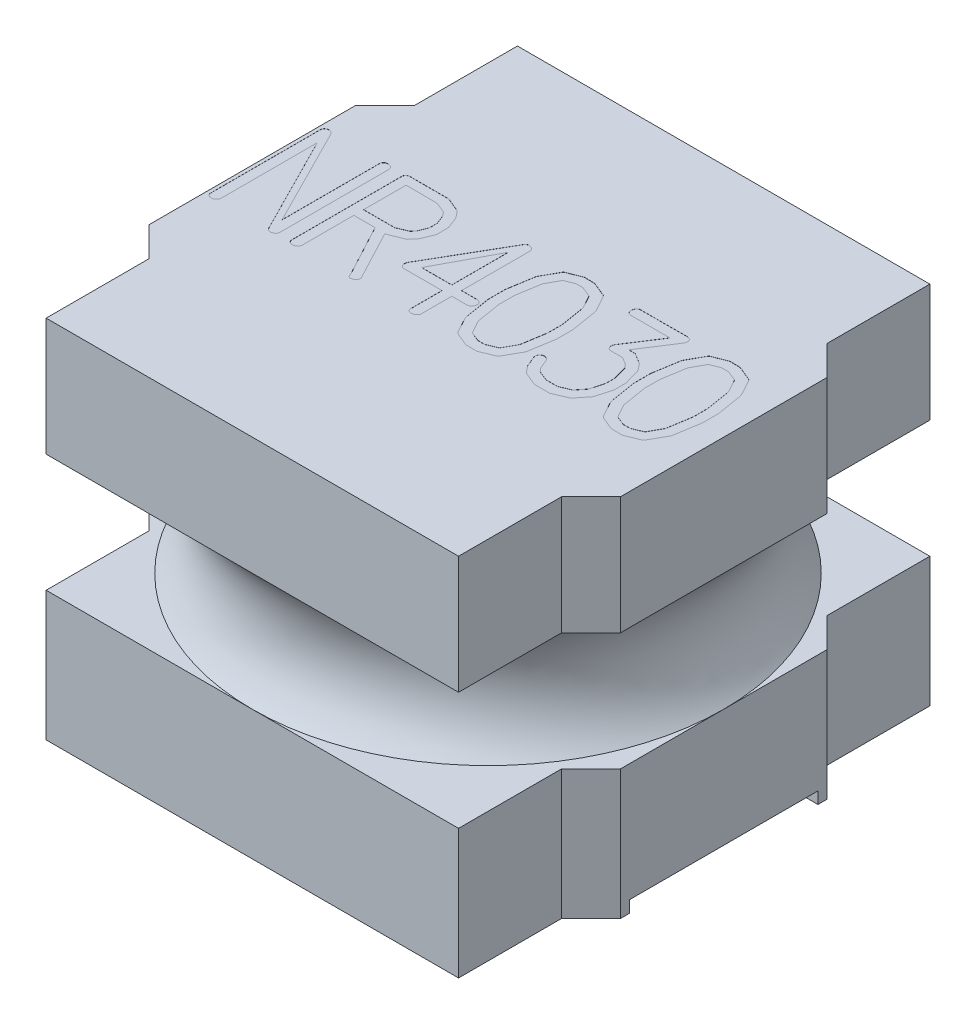
from build123d import *

# Parameters (mm, degrees)
BOSS_EXTRUDE1_START = -1.5
BOSS_EXTRUDE1_DEPTH = 1
CUT_EXTRUDE1_DEPTH  = 0.001
BOSS_EXTRUDE2_DEPTH = 0.1


with BuildPart() as part:
    # Sketch1 → Boss-Extrude1 (new body)
    with BuildSketch(Plane(origin=(0, 0, 0), x_dir=(1, 0, 0), z_dir=(0, 1, 0)).offset(BOSS_EXTRUDE1_START)):
        Polygon((-1.75, 2), (1.75, 2), (1.75, 1.125), (2, 0.875), (2, -0.875), (1.75, -1.125), (1.75, -2), (-1.75, -2), (-1.75, -1.125), (-2, -0.875), (-2, 0.875), (-1.75, 1.125), align=None)
    boss_extrude1 = extrude(amount=BOSS_EXTRUDE1_DEPTH)

    # Sketch2 → Revolve1 (revolve)
    with BuildSketch(Plane(origin=(0, 0, 0), x_dir=(0, 0, -1), z_dir=(1, 0, 0)), mode=Mode.PRIVATE) as revolve1_sk:
        with BuildLine():
            Line((-2, 0.5), (0, 0.5))
            Line((0, 0.5), (0, -0.5))
            Line((0, -0.5), (-2, -0.5))
            ThreePointArc((-2, -0.5), (-1.809016994, 0), (-2, 0.5))
        make_face()
    revolve(revolve1_sk.sketch.rotate(Axis((0, -1.5, 0), (0, 1, 0)), 180), axis=Axis((0, -1.5, 0), (0, 1, 0)))

    # Mirror1: Boss-Extrude1 across plane
    add(boss_extrude1.mirror(Plane.ZX))

    # Sketch3 → Cut-Extrude1 (cut)
    # profile 1 of 6: a face of its own
    with BuildSketch(Plane(origin=(0, 1.5, 0), x_dir=(1, 0, 0), z_dir=(0, 1, 0))):
        with BuildLine():
            Line((-1.896763393, 0.565182545), (-1.47172619, -0.275777276))
            Line((-1.47172619, -0.275777276), (-1.47172619, 0.556439986))
            add(Edge.make_bspline(
                [(-1.47172619, 0.556439986), (-1.470306395, 0.560142119), (-1.467630722, 0.567118969), (-1.460760161, 0.575623855), (-1.452434536, 0.581976469), (-1.445838877, 0.583797906), (-1.442522321, 0.584713795)],
                knots=[0, 0, 0, 0, 1.109185066, 2.09031286, 3.039734632, 4, 4, 4, 4], degree=3))
            add(Edge.make_bspline(
                [(-1.442522321, 0.584713795), (-1.436038113, 0.584478157), (-1.424379293, 0.584054471), (-1.408951724, 0.580032187), (-1.397195814, 0.572686768), (-1.393633727, 0.565223886), (-1.391927083, 0.561648319)],
                knots=[0, 0, 0, 0, 1.309736388, 2.354949205, 3.211834253, 4, 4, 4, 4], degree=3))
            Line((-1.391927083, 0.561648319), (-1.388392857, 0.549557545))
            Line((-1.388392857, 0.549557545), (-1.388392857, -0.383478169))
            add(Edge.make_bspline(
                [(-1.388392857, -0.383478169), (-1.389803322, -0.387527534), (-1.392568979, -0.395467575), (-1.401548089, -0.405193133), (-1.413923051, -0.411867685), (-1.423471144, -0.414095942), (-1.428571429, -0.415286205)],
                knots=[0, 0, 0, 0, 0.93883371, 1.840875961, 2.846665492, 4, 4, 4, 4], degree=3))
            add(Edge.make_bspline(
                [(-1.428571429, -0.415286205), (-1.432188471, -0.415176507), (-1.438883743, -0.414973452), (-1.447870125, -0.412720635), (-1.455385705, -0.409366324), (-1.458511029, -0.405444995), (-1.46000744, -0.403567455)],
                knots=[0, 0, 0, 0, 1.240813366, 2.296788812, 3.184498919, 4, 4, 4, 4], degree=3))
            Line((-1.46000744, -0.403567455), (-1.466517857, -0.394452871))
            Line((-1.466517857, -0.394452871), (-1.888392857, 0.439066474))
            Line((-1.888392857, 0.439066474), (-1.888392857, -0.381804062))
            add(Edge.make_bspline(
                [(-1.888392857, -0.381804062), (-1.889479385, -0.384979641), (-1.891736312, -0.391575932), (-1.898454551, -0.400472129), (-1.907811787, -0.408500211), (-1.915283117, -0.412924698), (-1.919270833, -0.415286205)],
                knots=[0, 0, 0, 0, 0.855881606, 1.777831308, 2.813949167, 4, 4, 4, 4], degree=3))
            Line((-1.919270833, -0.415286205), (-1.936011905, -0.415286205))
            add(Edge.make_bspline(
                [(-1.936011905, -0.415286205), (-1.938636346, -0.415227468), (-1.943726483, -0.415113546), (-1.950770904, -0.41286715), (-1.957229509, -0.410001889), (-1.962385618, -0.405405544), (-1.966543861, -0.399955988), (-1.969492153, -0.393737282), (-1.971498185, -0.386887024), (-1.971648412, -0.382067298), (-1.97172619, -0.379571919)],
                knots=[0, 0, 0, 0, 1.101665817, 2.136695196, 3.096220978, 4.06108244, 5.013447482, 5.972973263, 6.950521542, 8, 8, 8, 8], degree=3))
            Line((-1.97172619, -0.379571919), (-1.97172619, 0.554765879))
            add(Edge.make_bspline(
                [(-1.97172619, 0.554765879), (-1.970424232, 0.558274857), (-1.967871956, 0.56515363), (-1.960801213, 0.573792575), (-1.951543686, 0.58051624), (-1.944281464, 0.583270574), (-1.94047619, 0.584713795)],
                knots=[0, 0, 0, 0, 0.990101851, 1.940931574, 2.921085177, 4, 4, 4, 4], degree=3))
            add(Edge.make_bspline(
                [(-1.94047619, 0.584713795), (-1.936111566, 0.584449349), (-1.927664385, 0.583937548), (-1.915640252, 0.580381328), (-1.905043333, 0.574120683), (-1.899546284, 0.568186656), (-1.896763393, 0.565182545)],
                knots=[0, 0, 0, 0, 1.057654734, 2.046957308, 3.011268782, 4, 4, 4, 4], degree=3))
        make_face()
    # profile 2 of 6: a face of its own
    with BuildSketch(Plane(origin=(0, 1.5, 0), x_dir=(1, 0, 0), z_dir=(0, 1, 0))):
        with BuildLine():
            add(Edge.make_bspline(
                [(-0.916220238, 0.584713795), (-0.912819184, 0.583142877), (-0.905559586, 0.579789729), (-0.89386605, 0.574930794), (-0.881004782, 0.569184691), (-0.866662817, 0.563360852), (-0.851012308, 0.556763425), (-0.833973993, 0.54981334), (-0.815704558, 0.542046263), (-0.803010382, 0.53694798), (-0.796428571, 0.534304569)],
                knots=[0, 0, 0, 0, 0.69170389, 1.476452024, 2.33788276, 3.292567323, 4.33444127, 5.47407891, 6.69033371, 8, 8, 8, 8], degree=3))
            add(Edge.make_bspline(
                [(-0.796428571, 0.534304569), (-0.795365255, 0.533196905), (-0.792871733, 0.530599387), (-0.788930193, 0.52599228), (-0.783955072, 0.520404772), (-0.778535116, 0.513460678), (-0.771870613, 0.505651651), (-0.764518356, 0.496576426), (-0.75632609, 0.48635153), (-0.750662632, 0.479126604), (-0.747693452, 0.475338795)],
                knots=[0, 0, 0, 0, 0.481485898, 1.129104191, 1.901129329, 2.827469681, 3.890672923, 5.120764969, 6.490504369, 8, 8, 8, 8], degree=3))
            Line((-0.747693452, 0.475338795), (-0.708630952, 0.375636414))
            add(Edge.make_bspline(
                [(-0.708630952, 0.375636414), (-0.708442783, 0.369250132), (-0.708022631, 0.354990646), (-0.707378502, 0.33130738), (-0.707353284, 0.303153309), (-0.707216213, 0.282878298), (-0.707142857, 0.272027783)],
                knots=[0, 0, 0, 0, 0.739877275, 1.652020808, 2.743439316, 4, 4, 4, 4], degree=3))
            add(Edge.make_bspline(
                [(-0.707142857, 0.272027783), (-0.708833753, 0.268066448), (-0.712414149, 0.259678499), (-0.7177127, 0.246282734), (-0.723686208, 0.231596438), (-0.729956446, 0.216247789), (-0.735895517, 0.2014471), (-0.740808214, 0.188334392), (-0.745137178, 0.177862838), (-0.747576349, 0.171646102), (-0.748623512, 0.168977188)],
                knots=[0, 0, 0, 0, 0.930477767, 1.970244378, 3.112005238, 4.355764031, 5.552241039, 6.557257016, 7.380614275, 8, 8, 8, 8], degree=3))
            Line((-0.748623512, 0.168977188), (-0.796056548, 0.112615581))
            Line((-0.796056548, 0.112615581), (-0.802380952, 0.108523319))
            Line((-0.802380952, 0.108523319), (-0.918452381, 0.060904271))
            Line((-0.918452381, 0.060904271), (-0.93500744, 0.060904271))
            Line((-0.93500744, 0.060904271), (-0.71235119, -0.359668645))
            add(Edge.make_bspline(
                [(-0.71235119, -0.359668645), (-0.710840542, -0.362518567), (-0.708167134, -0.367562101), (-0.70745332, -0.373209441), (-0.707142857, -0.375665669)],
                knots=[0, 0, 0, 0, 1.130128936, 2, 2, 2, 2], degree=3))
            add(Edge.make_bspline(
                [(-0.707142857, -0.375665669), (-0.707288041, -0.379102057), (-0.707558426, -0.385501872), (-0.710834301, -0.390984218), (-0.71235119, -0.393522812)],
                knots=[0, 0, 0, 0, 1.073902397, 2, 2, 2, 2], degree=3))
            add(Edge.make_bspline(
                [(-0.71235119, -0.393522812), (-0.714349654, -0.396902888), (-0.718452493, -0.403842171), (-0.729761392, -0.410547182), (-0.743987225, -0.414627787), (-0.754660614, -0.414932615), (-0.760528274, -0.415100193)],
                knots=[0, 0, 0, 0, 0.833397318, 1.710961782, 2.741608977, 4, 4, 4, 4], degree=3))
            add(Edge.make_bspline(
                [(-0.760528274, -0.415100193), (-0.763007493, -0.413961421), (-0.768484487, -0.41144569), (-0.774695764, -0.403152782), (-0.780230676, -0.39201179), (-0.7828736, -0.383168872), (-0.784337798, -0.378269836)],
                knots=[0, 0, 0, 0, 0.710807694, 1.570288236, 2.65392335, 4, 4, 4, 4], degree=3))
            Line((-0.784337798, -0.378269836), (-1.019084821, 0.060904271))
            Line((-1.019084821, 0.060904271), (-1.199702381, 0.060904271))
            Line((-1.199702381, 0.060904271), (-1.199702381, -0.381990074))
            add(Edge.make_bspline(
                [(-1.199702381, -0.381990074), (-1.200703143, -0.385179467), (-1.202800313, -0.391863072), (-1.209811821, -0.400575425), (-1.219115439, -0.408814022), (-1.226813628, -0.413023225), (-1.230952381, -0.415286205)],
                knots=[0, 0, 0, 0, 0.845387553, 1.771571109, 2.801936792, 4, 4, 4, 4], degree=3))
            Line((-1.230952381, -0.415286205), (-1.247321429, -0.415286205))
            add(Edge.make_bspline(
                [(-1.247321429, -0.415286205), (-1.24994587, -0.415227468), (-1.255036007, -0.415113546), (-1.262080428, -0.41286715), (-1.268539033, -0.410001889), (-1.273695142, -0.405405544), (-1.277853385, -0.399955988), (-1.280801676, -0.393737282), (-1.282807708, -0.386887024), (-1.282957935, -0.382067298), (-1.283035714, -0.379571919)],
                knots=[0, 0, 0, 0, 1.101665817, 2.136695196, 3.096220978, 4.06108244, 5.013447482, 5.972973263, 6.950521542, 8, 8, 8, 8], degree=3))
            Line((-1.283035714, -0.379571919), (-1.283035714, 0.55588195))
            add(Edge.make_bspline(
                [(-1.283035714, 0.55588195), (-1.281821214, 0.559642222), (-1.279498142, 0.566834794), (-1.272703477, 0.575716703), (-1.263696193, 0.582136738), (-1.256595062, 0.583832062), (-1.252901786, 0.584713795)],
                knots=[0, 0, 0, 0, 1.064767976, 2.036666745, 2.978876548, 4, 4, 4, 4], degree=3))
            Line((-1.252901786, 0.584713795), (-0.916220238, 0.584713795))
        make_face()
        Polygon((-0.843861607, 0.466224212), (-0.934077381, 0.503054569), (-1.199702381, 0.504356652), (-1.199702381, 0.144237605), (-0.935379464, 0.144237605), (-0.843861607, 0.183300105), (-0.818377976, 0.214178081), (-0.787686012, 0.289698914), (-0.787686012, 0.357593259), (-0.818377976, 0.433114093), align=None, mode=Mode.SUBTRACT)
    # profile 3 of 6: a face of its own
    with BuildSketch(Plane(origin=(0, 1.5, 0), x_dir=(1, 0, 0), z_dir=(0, 1, 0))):
        with BuildLine():
            Line((-0.194233631, 0.561648319), (-0.189583333, 0.548813498))
            Line((-0.189583333, 0.548813498), (-0.189583333, -0.034333824))
            Line((-0.189583333, -0.034333824), (-0.055654762, -0.034519836))
            add(Edge.make_bspline(
                [(-0.055654762, -0.034519836), (-0.0505191, -0.035845237), (-0.04111382, -0.038272532), (-0.029358132, -0.045828156), (-0.021335425, -0.0563029), (-0.019798957, -0.064648792), (-0.019010417, -0.068932038)],
                knots=[0, 0, 0, 0, 1.169459646, 2.1417093, 3.046295384, 4, 4, 4, 4], degree=3))
            add(Edge.make_bspline(
                [(-0.019010417, -0.068932038), (-0.019167329, -0.072921736), (-0.019468311, -0.080574575), (-0.022363141, -0.091357533), (-0.026905325, -0.101037212), (-0.031695085, -0.106056245), (-0.034077381, -0.108552574)],
                knots=[0, 0, 0, 0, 1.095690159, 2.101697989, 3.055836587, 4, 4, 4, 4], degree=3))
            Line((-0.034077381, -0.108552574), (-0.051934524, -0.117667157))
            Line((-0.051934524, -0.117667157), (-0.189583333, -0.117667157))
            Line((-0.189583333, -0.117667157), (-0.189583333, -0.38161805))
            add(Edge.make_bspline(
                [(-0.189583333, -0.38161805), (-0.190501795, -0.384590956), (-0.19227155, -0.390319359), (-0.197093909, -0.397779375), (-0.203390314, -0.403784099), (-0.213173772, -0.40882583), (-0.224427688, -0.413148332), (-0.233393179, -0.414648726), (-0.237202381, -0.415286205)],
                knots=[0, 0, 0, 0, 0.895387976, 1.725295879, 2.536428694, 3.378620822, 4.886244683, 6, 6, 6, 6], degree=3))
            add(Edge.make_bspline(
                [(-0.237202381, -0.415286205), (-0.24000098, -0.415192141), (-0.245283265, -0.415014598), (-0.252686607, -0.413360266), (-0.258920132, -0.410530043), (-0.264244805, -0.406754867), (-0.26812442, -0.401568245), (-0.271025447, -0.395380956), (-0.272624796, -0.388083341), (-0.272816283, -0.382865378), (-0.272916667, -0.380129955)],
                knots=[0, 0, 0, 0, 1.168965484, 2.206392299, 3.145950951, 4.016860765, 4.903443245, 5.819468469, 6.856895284, 8, 8, 8, 8], degree=3))
            Line((-0.272916667, -0.380129955), (-0.272916667, -0.117667157))
            Line((-0.272916667, -0.117667157), (-0.600855655, -0.117667157))
            add(Edge.make_bspline(
                [(-0.600855655, -0.117667157), (-0.60441803, -0.116705645), (-0.611342046, -0.114836799), (-0.620277979, -0.108291522), (-0.626486277, -0.098628148), (-0.62881918, -0.091141604), (-0.630059524, -0.087161205)],
                knots=[0, 0, 0, 0, 0.981167136, 1.907046662, 2.887231297, 4, 4, 4, 4], degree=3))
            Line((-0.630059524, -0.087161205), (-0.630059524, -0.077674598))
            add(Edge.make_bspline(
                [(-0.630059524, -0.077674598), (-0.629803534, -0.073068197), (-0.629294815, -0.063914094), (-0.625207591, -0.055709114), (-0.623177083, -0.051632931)],
                knots=[0, 0, 0, 0, 1.00641232, 2, 2, 2, 2], degree=3))
            Line((-0.623177083, -0.051632931), (-0.580766369, 0.020911712))
            Line((-0.580766369, 0.020911712), (-0.261755952, 0.572437009))
            add(Edge.make_bspline(
                [(-0.261755952, 0.572437009), (-0.259564783, 0.5742872), (-0.255479413, 0.577736826), (-0.249078974, 0.581859249), (-0.242633996, 0.584225878), (-0.238334685, 0.584555619), (-0.236272321, 0.584713795)],
                knots=[0, 0, 0, 0, 1.18923455, 2.217292782, 3.144841935, 4, 4, 4, 4], degree=3))
            add(Edge.make_bspline(
                [(-0.236272321, 0.584713795), (-0.234404977, 0.5845061), (-0.230576814, 0.584080314), (-0.226839751, 0.583146151), (-0.224925595, 0.582667664)],
                knots=[0, 0, 0, 0, 0.975582543, 2, 2, 2, 2], degree=3))
            add(Edge.make_bspline(
                [(-0.224925595, 0.582667664), (-0.220883993, 0.581673517), (-0.213537628, 0.579866468), (-0.204408508, 0.574859942), (-0.197380358, 0.569136499), (-0.195246675, 0.564059032), (-0.194233631, 0.561648319)],
                knots=[0, 0, 0, 0, 1.277997596, 2.322998947, 3.203782403, 4, 4, 4, 4], degree=3))
        make_face()
        Polygon((-0.527938988, -0.034333824), (-0.272916667, -0.034333824), (-0.272916667, 0.444460819), align=None, mode=Mode.SUBTRACT)
    # profile 4 of 6: a face of its own
    with BuildSketch(Plane(origin=(0, 1.5, 0), x_dir=(1, 0, 0), z_dir=(0, 1, 0))):
        with BuildLine():
            add(Edge.make_bspline(
                [(0.322767857, 0.583039688), (0.326173058, 0.581539845), (0.333519924, 0.57830387), (0.345352397, 0.573403138), (0.358592366, 0.567664507), (0.373482234, 0.561912306), (0.389655505, 0.555102658), (0.407338652, 0.547784533), (0.426678355, 0.540329583), (0.439965264, 0.534887365), (0.446837798, 0.532072426)],
                knots=[0, 0, 0, 0, 0.665720275, 1.436320058, 2.291406459, 3.247277281, 4.291804095, 5.431067394, 6.671242782, 8, 8, 8, 8], degree=3))
            Line((0.446837798, 0.532072426), (0.458928571, 0.517563498))
            Line((0.458928571, 0.517563498), (0.530543155, 0.384937009))
            Line((0.530543155, 0.384937009), (0.534635417, 0.370986117))
            Line((0.534635417, 0.370986117), (0.570535714, 0.150189986))
            Line((0.570535714, 0.150189986), (0.570535714, 0.012727188))
            Line((0.570535714, 0.012727188), (0.533333333, -0.213463288))
            Line((0.533333333, -0.213463288), (0.530357143, -0.21755555))
            Line((0.530357143, -0.21755555), (0.451116071, -0.35911061))
            Line((0.451116071, -0.35911061), (0.443861607, -0.365249002))
            add(Edge.make_bspline(
                [(0.443861607, -0.365249002), (0.439383629, -0.36676168), (0.429864848, -0.369977158), (0.41494761, -0.375927253), (0.398238292, -0.382547328), (0.380533743, -0.389936864), (0.363037839, -0.39729067), (0.347226445, -0.404193145), (0.33350565, -0.409898418), (0.325241332, -0.413596661), (0.321465774, -0.415286205)],
                knots=[0, 0, 0, 0, 0.857514317, 1.822807192, 2.913398912, 4.118988428, 5.303819582, 6.357154914, 7.249465436, 8, 8, 8, 8], degree=3))
            Line((0.321465774, -0.415286205), (0.228087798, -0.415286205))
            add(Edge.make_bspline(
                [(0.228087798, -0.415286205), (0.220569275, -0.412411992), (0.203961657, -0.406063162), (0.177016278, -0.394651666), (0.145230402, -0.381628066), (0.12260421, -0.371918981), (0.110528274, -0.366737098)],
                knots=[0, 0, 0, 0, 0.759314602, 1.677245352, 2.760311232, 4, 4, 4, 4], degree=3))
            Line((0.110528274, -0.366737098), (0.100111607, -0.356134419))
            Line((0.100111607, -0.356134419), (0.025892857, -0.218113586))
            Line((0.025892857, -0.218113586), (0.023102679, -0.207882931))
            Line((0.023102679, -0.207882931), (-0.012797619, 0.014773319))
            Line((-0.012797619, 0.014773319), (-0.012797619, 0.159490581))
            Line((-0.012797619, 0.159490581), (0.023474702, 0.382146831))
            Line((0.023474702, 0.382146831), (0.02719494, 0.39181945))
            Line((0.02719494, 0.39181945), (0.102529762, 0.527050105))
            Line((0.102529762, 0.527050105), (0.112388393, 0.536722724))
            add(Edge.make_bspline(
                [(0.112388393, 0.536722724), (0.116307082, 0.538053111), (0.124947841, 0.540986631), (0.138756573, 0.546577625), (0.155077767, 0.552543385), (0.17269281, 0.559762622), (0.190316997, 0.567220509), (0.206694697, 0.573528655), (0.220684727, 0.579441596), (0.229323774, 0.582925729), (0.233296131, 0.584527783)],
                knots=[0, 0, 0, 0, 0.76366452, 1.683889708, 2.748731425, 3.970665397, 5.196932387, 6.280730219, 7.209455205, 8, 8, 8, 8], degree=3))
            Line((0.233296131, 0.584527783), (0.322767857, 0.583039688))
        make_face()
        Polygon((0.39140625, 0.466968259), (0.30453869, 0.501380462), (0.245572917, 0.501380462), (0.165215774, 0.468642367), (0.103831845, 0.357407248), (0.070535714, 0.15260814), (0.070535714, 0.021841771), (0.104947917, -0.187049598), (0.166331845, -0.299400788), (0.245386905, -0.331952871), (0.303980655, -0.331952871), (0.392522321, -0.294936502), (0.454092262, -0.183515371), (0.487202381, 0.021841771), (0.487202381, 0.142563498), (0.45297619, 0.354059033), align=None, mode=Mode.SUBTRACT)
    # profile 5 of 6: a face of its own
    with BuildSketch(Plane(origin=(0, 1.5, 0), x_dir=(1, 0, 0), z_dir=(0, 1, 0))):
        with BuildLine():
            add(Edge.make_bspline(
                [(1.146130952, 0.545465283), (1.145966982, 0.543463528), (1.145598806, 0.538968833), (1.142876033, 0.531946606), (1.138973509, 0.523915999), (1.135527522, 0.518460835), (1.133668155, 0.515517367)],
                knots=[0, 0, 0, 0, 0.731496768, 1.642485333, 2.72794448, 4, 4, 4, 4], degree=3))
            add(Edge.make_bspline(
                [(1.133668155, 0.515517367), (1.131679496, 0.512354181), (1.128392186, 0.507125346), (1.126340565, 0.503939229), (1.122508292, 0.497825042), (1.123371227, 0.498708449), (1.1234375, 0.498776295)],
                knots=[0, 0, 0, 0, 2.008375184, 3.31990065, 3.947768297, 4, 4, 4, 4], degree=3))
            Line((1.1234375, 0.498776295), (0.955840774, 0.2394757))
            Line((0.955840774, 0.2394757), (1.00922619, 0.2394757))
            add(Edge.make_bspline(
                [(1.00922619, 0.2394757), (1.014874125, 0.236136807), (1.027442324, 0.228706856), (1.048111917, 0.216177336), (1.072622951, 0.201288147), (1.090321772, 0.190669302), (1.099813988, 0.184974212)],
                knots=[0, 0, 0, 0, 0.744723836, 1.65721417, 2.743519113, 4, 4, 4, 4], degree=3))
            Line((1.099813988, 0.184974212), (1.13999256, 0.136053081))
            add(Edge.make_bspline(
                [(1.13999256, 0.136053081), (1.141094935, 0.134531506), (1.143697635, 0.130939082), (1.146767237, 0.123979408), (1.1504111, 0.115234897), (1.15245495, 0.108608723), (1.153571429, 0.104989093)],
                knots=[0, 0, 0, 0, 0.660434001, 1.559278996, 2.666725834, 4, 4, 4, 4], degree=3))
            add(Edge.make_bspline(
                [(1.153571429, 0.104989093), (1.155674377, 0.097423155), (1.16034781, 0.080609187), (1.168202323, 0.052843165), (1.17749544, 0.019916962), (1.184199629, -0.003766363), (1.187797619, -0.016476681)],
                knots=[0, 0, 0, 0, 0.746719963, 1.659454107, 2.743880703, 4, 4, 4, 4], degree=3))
            Line((1.187797619, -0.016476681), (1.187797619, -0.115435014))
            add(Edge.make_bspline(
                [(1.187797619, -0.115435014), (1.183981622, -0.128880564), (1.176691243, -0.154567995), (1.166787961, -0.191471332), (1.157492077, -0.224747523), (1.152051218, -0.245882764), (1.149479167, -0.255874002)],
                knots=[0, 0, 0, 0, 1.152088605, 2.201040242, 3.149579839, 4, 4, 4, 4], degree=3))
            add(Edge.make_bspline(
                [(1.149479167, -0.255874002), (1.148307478, -0.257490819), (1.145345512, -0.261578044), (1.139781751, -0.26878772), (1.13200663, -0.27823063), (1.122713436, -0.290451238), (1.110763051, -0.304562996), (1.097603618, -0.321703154), (1.081819807, -0.34069679), (1.070839086, -0.354320941), (1.065029762, -0.361528764)],
                knots=[0, 0, 0, 0, 0.354260306, 0.895550937, 1.615424868, 2.52432519, 3.618802696, 4.895348182, 6.357491474, 8, 8, 8, 8], degree=3))
            add(Edge.make_bspline(
                [(1.065029762, -0.361528764), (1.060515732, -0.36366402), (1.050930409, -0.368198131), (1.035375925, -0.37484548), (1.017979567, -0.382107947), (0.999316539, -0.389396593), (0.980982174, -0.396451597), (0.964686447, -0.40331462), (0.950984084, -0.409468379), (0.942811076, -0.413469356), (0.939099702, -0.415286205)],
                knots=[0, 0, 0, 0, 0.874918988, 1.85784809, 2.963529072, 4.178080018, 5.368433221, 6.405587914, 7.27597554, 8, 8, 8, 8], degree=3))
            Line((0.939099702, -0.415286205), (0.808891369, -0.415286205))
            add(Edge.make_bspline(
                [(0.808891369, -0.415286205), (0.80162127, -0.412472525), (0.785512274, -0.406238008), (0.759311799, -0.39501506), (0.728268688, -0.382178249), (0.706136242, -0.372600021), (0.694308036, -0.367481145)],
                knots=[0, 0, 0, 0, 0.753366235, 1.669299668, 2.754407724, 4, 4, 4, 4], degree=3))
            add(Edge.make_bspline(
                [(0.694308036, -0.367481145), (0.693486673, -0.366752221), (0.691416109, -0.364914684), (0.688196758, -0.361066912), (0.683628916, -0.356078826), (0.678140798, -0.349547589), (0.671426694, -0.341751415), (0.663569559, -0.33261239), (0.654701117, -0.322072569), (0.648480483, -0.314535259), (0.645200893, -0.310561502)],
                knots=[0, 0, 0, 0, 0.350081131, 0.882515176, 1.597343563, 2.509514018, 3.604118565, 4.881157203, 6.35571015, 8, 8, 8, 8], degree=3))
            Line((0.645200893, -0.310561502), (0.604464286, -0.213835312))
            Line((0.604464286, -0.213835312), (0.604464286, -0.203418645))
            add(Edge.make_bspline(
                [(0.604464286, -0.203418645), (0.604783998, -0.198378384), (0.605390145, -0.18882248), (0.6105721, -0.180797268), (0.613020833, -0.177004955)],
                knots=[0, 0, 0, 0, 1.054899985, 2, 2, 2, 2], degree=3))
            add(Edge.make_bspline(
                [(0.613020833, -0.177004955), (0.615484388, -0.174962741), (0.620435161, -0.170858695), (0.629456985, -0.166810099), (0.6394831, -0.16431489), (0.646548635, -0.164097289), (0.650223214, -0.163984121)],
                knots=[0, 0, 0, 0, 0.947468225, 1.904037492, 2.909950893, 4, 4, 4, 4], degree=3))
            add(Edge.make_bspline(
                [(0.650223214, -0.163984121), (0.654167331, -0.16557506), (0.661437519, -0.168507636), (0.670865793, -0.173685002), (0.677744265, -0.179774907), (0.680287127, -0.18460885), (0.681473214, -0.186863586)],
                knots=[0, 0, 0, 0, 1.28205388, 2.363209, 3.236538274, 4, 4, 4, 4], degree=3))
            Line((0.681473214, -0.186863586), (0.715885417, -0.269452871))
            Line((0.715885417, -0.269452871), (0.741741071, -0.298656741))
            Line((0.741741071, -0.298656741), (0.825074405, -0.331952871))
            Line((0.825074405, -0.331952871), (0.921056548, -0.331952871))
            Line((0.921056548, -0.331952871), (1.012202381, -0.294192455))
            Line((1.012202381, -0.294192455), (1.072098214, -0.220903764))
            Line((1.072098214, -0.220903764), (1.104464286, -0.102972217))
            Line((1.104464286, -0.102972217), (1.104464286, -0.027823407))
            Line((1.104464286, -0.027823407), (1.072842262, 0.088248021))
            Line((1.072842262, 0.088248021), (1.045126488, 0.120614093))
            Line((1.045126488, 0.120614093), (0.985602679, 0.156142367))
            Line((0.985602679, 0.156142367), (0.879575893, 0.156142367))
            add(Edge.make_bspline(
                [(0.879575893, 0.156142367), (0.875780938, 0.157371714), (0.868398763, 0.159763115), (0.859661952, 0.167748587), (0.85380116, 0.17841488), (0.85241469, 0.186570347), (0.851674107, 0.190926593)],
                knots=[0, 0, 0, 0, 0.993260278, 1.932149966, 2.895457034, 4, 4, 4, 4], degree=3))
            add(Edge.make_bspline(
                [(0.851674107, 0.190926593), (0.851758519, 0.196174182), (0.851907411, 0.205430218), (0.855898217, 0.213741133), (0.857626488, 0.217340283)],
                knots=[0, 0, 0, 0, 1.133873875, 2, 2, 2, 2], degree=3))
            Line((0.857626488, 0.217340283), (1.041964286, 0.501380462))
            Line((1.041964286, 0.501380462), (0.703980655, 0.501380462))
            add(Edge.make_bspline(
                [(0.703980655, 0.501380462), (0.700479643, 0.502415304), (0.693604631, 0.504447447), (0.684743659, 0.511150916), (0.67846783, 0.521005042), (0.676304048, 0.528705313), (0.67514881, 0.532816474)],
                knots=[0, 0, 0, 0, 0.961552233, 1.888220791, 2.872524955, 4, 4, 4, 4], degree=3))
            add(Edge.make_bspline(
                [(0.67514881, 0.532816474), (0.675331973, 0.537925971), (0.675671285, 0.547391371), (0.678893736, 0.560381971), (0.683923761, 0.571314117), (0.689302235, 0.576593477), (0.691889881, 0.579133438)],
                knots=[0, 0, 0, 0, 1.204793626, 2.231893546, 3.149343424, 4, 4, 4, 4], degree=3))
            Line((0.691889881, 0.579133438), (0.703050595, 0.5832257))
            Line((0.703050595, 0.5832257), (1.095349702, 0.584713795))
            add(Edge.make_bspline(
                [(1.095349702, 0.584713795), (1.099325852, 0.584637454), (1.106771215, 0.584494505), (1.117200648, 0.582657804), (1.126072565, 0.579497122), (1.133480781, 0.575246819), (1.139438302, 0.569679813), (1.143264993, 0.562538599), (1.145821127, 0.554381007), (1.14602462, 0.548525174), (1.146130952, 0.545465283)],
                knots=[0, 0, 0, 0, 1.302296161, 2.438557397, 3.454453739, 4.374755197, 5.222865942, 6.087619718, 7.000710084, 8, 8, 8, 8], degree=3))
        make_face()
    # profile 6 of 6: a face of its own
    with BuildSketch(Plane(origin=(0, 1.5, 0), x_dir=(1, 0, 0), z_dir=(0, 1, 0))):
        with BuildLine():
            add(Edge.make_bspline(
                [(1.557291667, 0.583039688), (1.560696867, 0.581539845), (1.568043734, 0.57830387), (1.579876207, 0.573403138), (1.593116175, 0.567664507), (1.608006044, 0.561912306), (1.624179314, 0.555102658), (1.641862461, 0.547784533), (1.661202164, 0.540329583), (1.674489073, 0.534887365), (1.681361607, 0.532072426)],
                knots=[0, 0, 0, 0, 0.665720275, 1.436320058, 2.291406459, 3.247277281, 4.291804095, 5.431067394, 6.671242782, 8, 8, 8, 8], degree=3))
            Line((1.681361607, 0.532072426), (1.693452381, 0.517563498))
            Line((1.693452381, 0.517563498), (1.765066964, 0.384937009))
            Line((1.765066964, 0.384937009), (1.769159226, 0.370986117))
            Line((1.769159226, 0.370986117), (1.805059524, 0.150189986))
            Line((1.805059524, 0.150189986), (1.805059524, 0.012727188))
            Line((1.805059524, 0.012727188), (1.767857143, -0.213463288))
            Line((1.767857143, -0.213463288), (1.764880952, -0.21755555))
            Line((1.764880952, -0.21755555), (1.685639881, -0.35911061))
            Line((1.685639881, -0.35911061), (1.678385417, -0.365249002))
            add(Edge.make_bspline(
                [(1.678385417, -0.365249002), (1.673907438, -0.36676168), (1.664388658, -0.369977158), (1.64947142, -0.375927253), (1.632762102, -0.382547328), (1.615057552, -0.389936864), (1.597561649, -0.39729067), (1.581750255, -0.404193145), (1.568029459, -0.409898418), (1.559765141, -0.413596661), (1.555989583, -0.415286205)],
                knots=[0, 0, 0, 0, 0.857514317, 1.822807192, 2.913398912, 4.118988428, 5.303819582, 6.357154914, 7.249465436, 8, 8, 8, 8], degree=3))
            Line((1.555989583, -0.415286205), (1.462611607, -0.415286205))
            add(Edge.make_bspline(
                [(1.462611607, -0.415286205), (1.455093085, -0.412411992), (1.438485467, -0.406063162), (1.411540087, -0.394651666), (1.379754212, -0.381628066), (1.357128019, -0.371918981), (1.345052083, -0.366737098)],
                knots=[0, 0, 0, 0, 0.759314602, 1.677245352, 2.760311232, 4, 4, 4, 4], degree=3))
            Line((1.345052083, -0.366737098), (1.334635417, -0.356134419))
            Line((1.334635417, -0.356134419), (1.260416667, -0.218113586))
            Line((1.260416667, -0.218113586), (1.257626488, -0.207882931))
            Line((1.257626488, -0.207882931), (1.22172619, 0.014773319))
            Line((1.22172619, 0.014773319), (1.22172619, 0.159490581))
            Line((1.22172619, 0.159490581), (1.257998512, 0.382146831))
            Line((1.257998512, 0.382146831), (1.26171875, 0.39181945))
            Line((1.26171875, 0.39181945), (1.337053571, 0.527050105))
            Line((1.337053571, 0.527050105), (1.346912202, 0.536722724))
            add(Edge.make_bspline(
                [(1.346912202, 0.536722724), (1.350830892, 0.538053111), (1.359471651, 0.540986631), (1.373280382, 0.546577625), (1.389601577, 0.552543385), (1.40721662, 0.559762622), (1.424840806, 0.567220509), (1.441218507, 0.573528655), (1.455208536, 0.579441596), (1.463847583, 0.582925729), (1.46781994, 0.584527783)],
                knots=[0, 0, 0, 0, 0.76366452, 1.683889708, 2.748731425, 3.970665397, 5.196932387, 6.280730219, 7.209455205, 8, 8, 8, 8], degree=3))
            Line((1.46781994, 0.584527783), (1.557291667, 0.583039688))
        make_face()
        Polygon((1.62593006, 0.466968259), (1.5390625, 0.501380462), (1.480096726, 0.501380462), (1.399739583, 0.468642367), (1.338355655, 0.357407248), (1.305059524, 0.15260814), (1.305059524, 0.021841771), (1.339471726, -0.187049598), (1.400855655, -0.299400788), (1.479910714, -0.331952871), (1.538504464, -0.331952871), (1.627046131, -0.294936502), (1.688616071, -0.183515371), (1.72172619, 0.021841771), (1.72172619, 0.142563498), (1.6875, 0.354059033), align=None, mode=Mode.SUBTRACT)
    extrude(amount=-CUT_EXTRUDE1_DEPTH, mode=Mode.SUBTRACT)

    # Sketch4 → Boss-Extrude2 (add)
    with BuildSketch(Plane.XZ.offset(1.5)):
        Polygon((-2, 0.8), (2, 0.8), (2, 0.875), (1.75, 1.125), (1.75, 2), (-1.75, 2), (-1.75, 1.125), (-2, 0.875), align=None)
        Polygon((-1.75, -1.125), (-2, -0.875), (-2, -0.8), (2, -0.8), (2, -0.875), (1.75, -1.125), (1.75, -2), (-1.75, -2), align=None)
    extrude(amount=BOSS_EXTRUDE2_DEPTH)


solid = part.part
